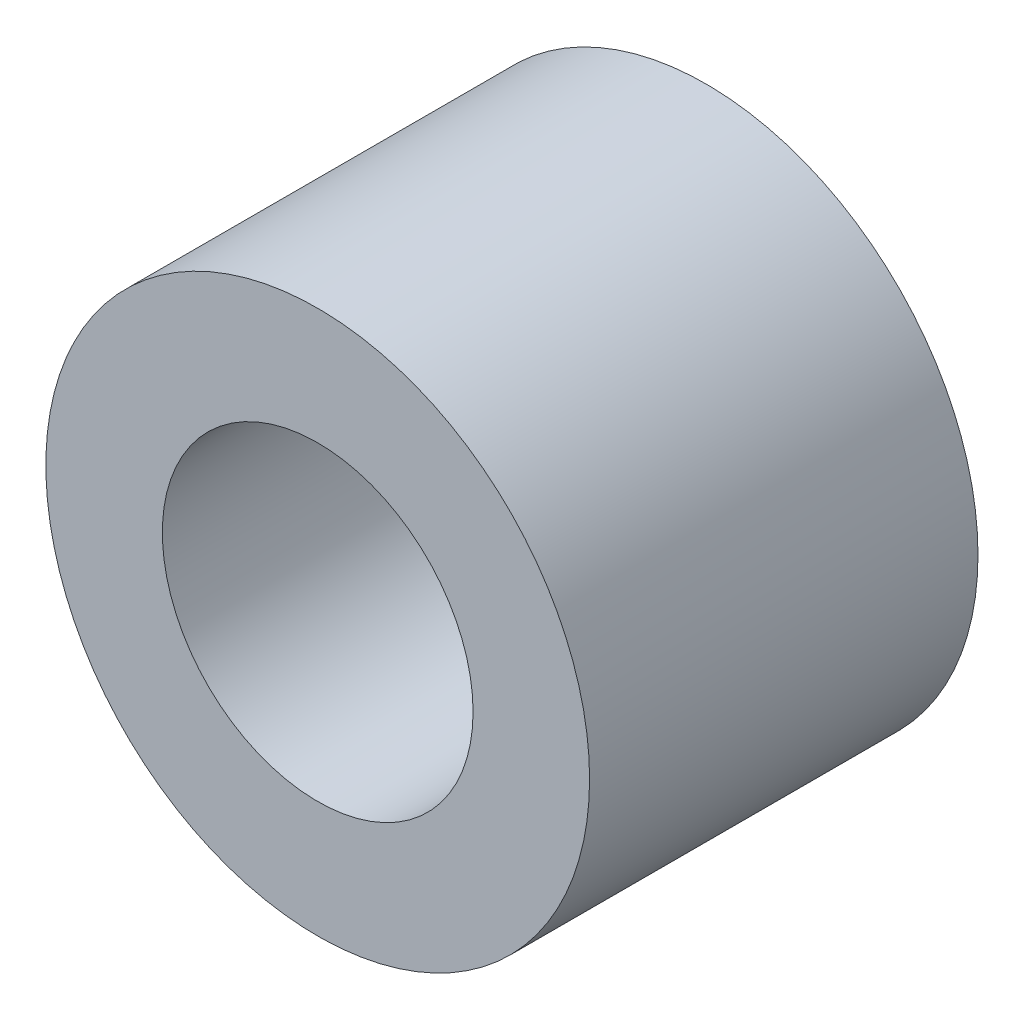
from build123d import *

# Parameters (mm, degrees)
SKETCH_1_R      = 7
SKETCH_1_R_2    = 4
EXTRUDE_1_DEPTH = 10


with BuildPart() as part:
    # 草图1 → 凸台-拉伸1 (new body)
    with BuildSketch(Plane.XY):
        Circle(SKETCH_1_R)
        Circle(SKETCH_1_R_2, mode=Mode.SUBTRACT)
    extrude(amount=EXTRUDE_1_DEPTH)


solid = part.part
